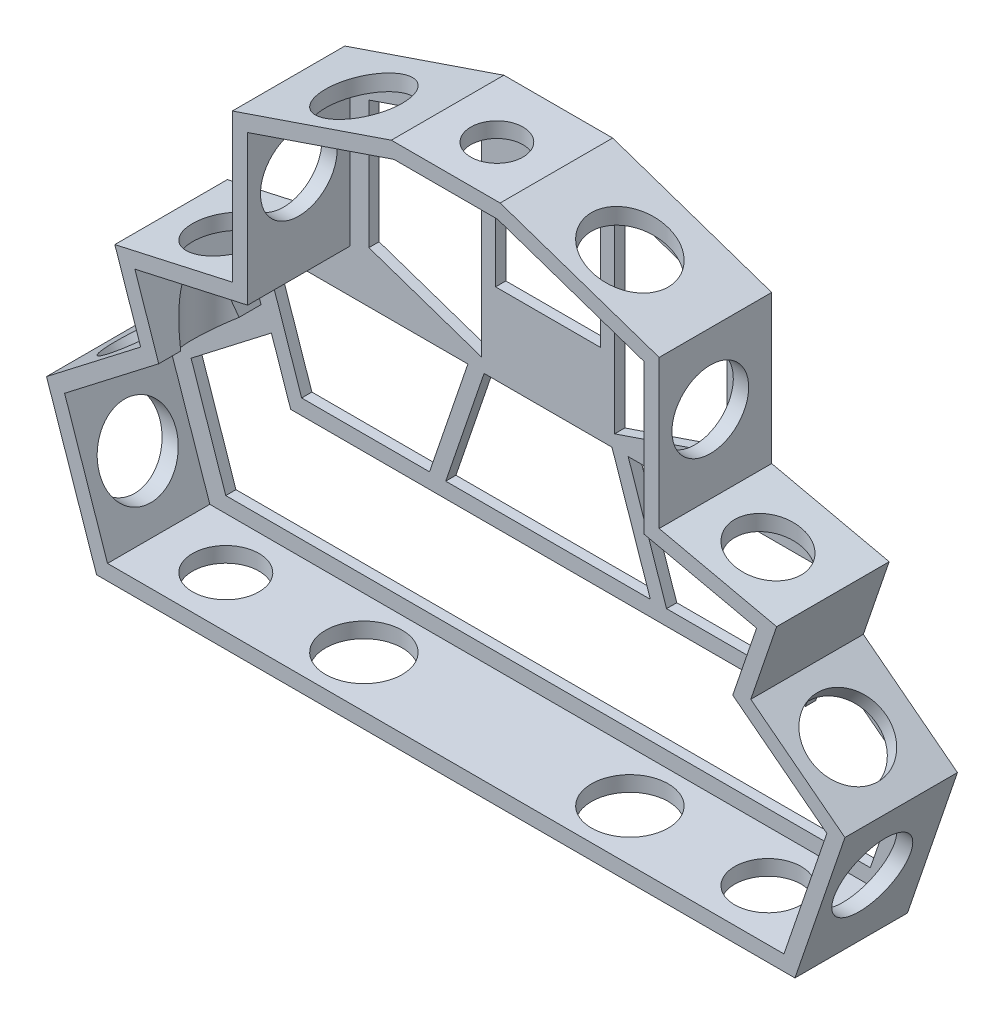
from build123d import *

# Parameters (mm, degrees)
EXTRUDE_THIN3_DEPTH     = 20
SKETCH5_W               = 20.5
SKETCH5_H               = 20.5
BOSS_EXTRUDE2_DEPTH     = 2
SKETCH6_R               = 5.1
CUT_EXTRUDE1_DEPTH      = 5
CUT_EXTRUDE2_DEPTH      = 113.143625411
CUT_EXTRUDE2_DEPTH_BACK = 113.143625411
SKETCH7_R               = 7.5
SKETCH7_R_2             = 6.5
CUT_EXTRUDE3_DEPTH      = 113.143625411
CUT_EXTRUDE3_DEPTH_BACK = 113.143625411
SKETCH8_R               = 7.5
SKETCH9_R               = 7.5
CUT_EXTRUDE4_DEPTH      = 5
SKETCH10_R              = 7.5
CUT_EXTRUDE5_DEPTH      = 5


with BuildPart() as part:
    # Sketch4 → Extrude-Thin3 (new body)
    with BuildSketch(Plane.XY):
        Polygon((68.26921232, -78.007734737), (-68.26921232, -78.007734737), (-78.04476947, -49.332767098), (-59.641599788, -35.135114275), (-64.69543331, -20.310535944), (-41.7225, -15.181760387), (-41.7225, 13.794543937), (-10.635850775, 24.392265263), (10.635850775, 24.392265263), (41.7225, 13.794543937), (41.7225, -15.181760387), (64.69543331, -20.310535944), (59.641599788, -35.135114275), (78.04476947, -49.332767098), align=None)
        Polygon((66.122401602, -75.007734737), (-66.122401602, -75.007734737), (-74.512519059, -50.396723531), (-56.109349377, -36.199070708), (-60.776273805, -22.509425719), (-38.7225, -17.58585525), (-38.7225, 11.647733219), (-10.138539336, 21.392265263), (10.138539336, 21.392265263), (38.7225, 11.647733219), (38.7225, -17.58585525), (60.776273805, -22.509425719), (56.109349377, -36.199070708), (74.512519059, -50.396723531), align=None, mode=Mode.SUBTRACT)
    extrude(amount=EXTRUDE_THIN3_DEPTH)

    # Sketch5 → Boss-Extrude2 (add)
    with BuildSketch(Plane.XY):
        Polygon((10.635850775, 24.392265263), (41.7225, 13.794543937), (41.7225, -15.181760387), (64.69543331, -20.310535944), (59.641599788, -35.135114275), (78.04476947, -49.332767098), (68.26921232, -78.007734737), (-68.26921232, -78.007734737), (-78.04476947, -49.332767098), (-59.641599788, -35.135114275), (-64.69543331, -20.310535944), (-41.7225, -15.181760387), (-41.7225, 13.794543937), (-10.635850775, 24.392265263), align=None)
        Rectangle(SKETCH5_W, SKETCH5_H, mode=Mode.SUBTRACT)
        Polygon((55.669537991, -26.0225), (48.169537991, -48.0225), (23.169537991, -48.0225), (15.669537991, -26.0225), align=None, mode=Mode.SUBTRACT)
        Polygon((-20, -48.0225), (20, -48.0225), (12.5, -26.0225), (-12.5, -26.0225), align=None, mode=Mode.SUBTRACT)
        Polygon((-15.669537991, -26.0225), (-23.169537991, -48.0225), (-48.169537991, -48.0225), (-55.669537991, -26.0225), align=None, mode=Mode.SUBTRACT)
        Polygon((13.0225, 16.5), (35.0225, 9), (35.0225, -16), (13.0225, -23.5), align=None, mode=Mode.SUBTRACT)
        Polygon((-35.0225, -16), (-13.0225, -23.5), (-13.0225, 16.5), (-35.0225, 9), align=None, mode=Mode.SUBTRACT)
        Polygon((-54.081215036, -39.978892106), (-69.782858952, -52.092375431), (-63.008353643, -71.964257668), (63.008353643, -71.964257668), (69.782858952, -52.092375431), (54.081215036, -39.978892106), (50.316348709, -51.0225), (-50.316348709, -51.0225), align=None, mode=Mode.SUBTRACT)
    extrude(amount=-BOSS_EXTRUDE2_DEPTH)

    # Sketch6 → Cut-Extrude1 (cut)
    with BuildSketch(Plane(origin=(0, 24.392265263, 0), x_dir=(1, 0, 0), z_dir=(0, 1, 0))):
        with Locations(Location((0, -10.000182073, 0), (0, 0, 180))):
            Circle(SKETCH6_R)
    extrude(amount=-CUT_EXTRUDE1_DEPTH, mode=Mode.SUBTRACT)

    # Sketch7 → Cut-Extrude2 (cut, two sides: drawn at the far end of the back side and taken through both)
    with BuildSketch(Plane(origin=(0, 0, 0), x_dir=(1, 0, 0), z_dir=(0, 1, 0)).offset(-CUT_EXTRUDE2_DEPTH_BACK)):
        with Locations((-26, -10)):
            Circle(SKETCH7_R)
        with Locations((-53, -10)):
            Circle(SKETCH7_R_2)
        with Locations(Location((26, -10, 0), (0, 0, 180))):
            Circle(SKETCH7_R)
        with Locations(Location((53, -10, 0), (0, 0, 180))):
            Circle(SKETCH7_R_2)
    extrude(amount=CUT_EXTRUDE2_DEPTH + CUT_EXTRUDE2_DEPTH_BACK, mode=Mode.SUBTRACT)

    # Sketch8 → Cut-Extrude3 (cut, two sides: drawn at the far end of the back side and taken through both)
    with BuildSketch(Plane(origin=(0, 0, 0), x_dir=(0, 0, -1), z_dir=(1, 0, 0)).offset(-CUT_EXTRUDE3_DEPTH_BACK)):
        with Locations((-10, 0)):
            Circle(SKETCH8_R)
        with Locations(Location((-10, -63, 0), (0, 0, 270))):
            Circle(SKETCH8_R)
    extrude(amount=CUT_EXTRUDE3_DEPTH + CUT_EXTRUDE3_DEPTH_BACK, mode=Mode.SUBTRACT)

    # Sketch9 → Cut-Extrude4 (cut)
    with BuildSketch(Plane(origin=(5.260509798, 6.818736564, 0), x_dir=(0.7917630726515511, -0.6108283202221183, 0), z_dir=(0.6108283202221182, 0.791763072651551, 0))):
        with Locations(Location((80, -10, 0), (0, 0, 180))):
            Circle(SKETCH9_R)
    extrude(amount=-CUT_EXTRUDE4_DEPTH, mode=Mode.SUBTRACT)

    # Sketch10 → Cut-Extrude5 (cut)
    with BuildSketch(Plane(origin=(-5.260509798, 6.818736564, 0), x_dir=(0.7917630726515507, 0.6108283202221189, 0), z_dir=(-0.6108283202221189, 0.7917630726515507, 0))):
        with Locations(Location((-80, -10, 0), (0, 0, 180))):
            Circle(SKETCH10_R)
    extrude(amount=-CUT_EXTRUDE5_DEPTH, mode=Mode.SUBTRACT)


solid = part.part
